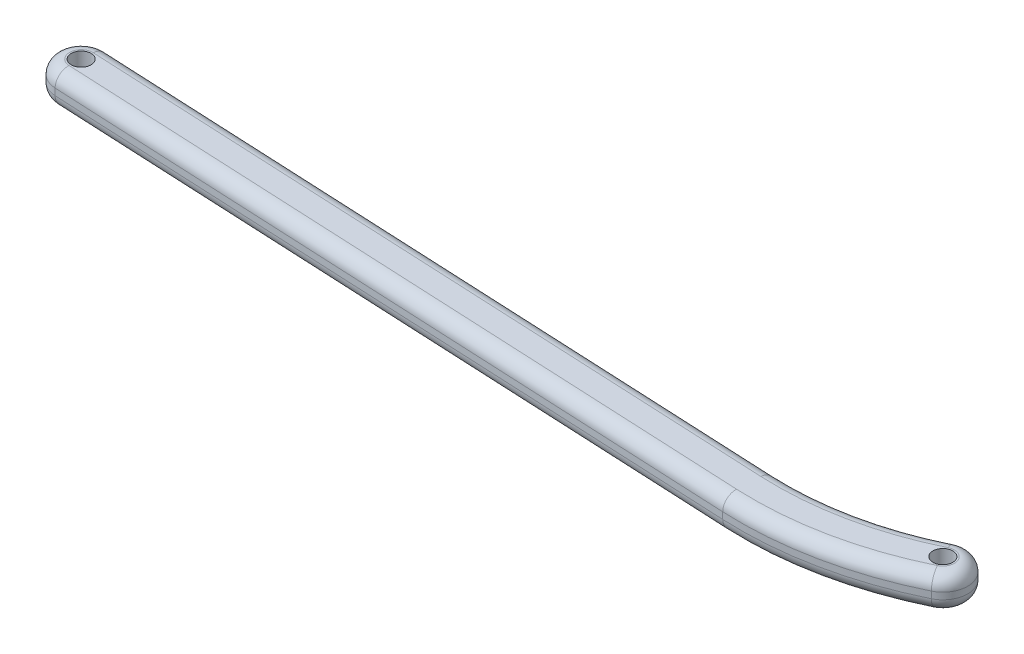
from build123d import *

# Parameters (mm, degrees)
CROQUIS1_R              = 3
SALIENTE_EXTRUIR1_DEPTH = 5
REDONDEO7_R             = 4


with BuildPart() as part:
    # Croquis1 → Saliente-Extruir1 (new, symmetric)
    with BuildSketch(Plane(origin=(0, 0, 0), x_dir=(-1, 0, 0), z_dir=(0, 1, 0))):
        with BuildLine():
            Line((48.918375148, 17.499676772), (260.354605919, 7.491612286))
            ThreePointArc((260.354605919, 7.491612286), (267.491612286, -0.354605919), (259.645394081, -7.491612286))
            Line((259.645394081, -7.491612286), (48.20916331, 2.5164522))
            ThreePointArc((48.20916331, 2.5164522), (25.165540725, 0.716123081), (3.287676773, -6.741007449))
            ThreePointArc((3.287676773, -6.741007449), (-6.741007449, -3.287676773), (-3.287676773, 6.741007449))
            ThreePointArc((-3.287676773, 6.741007449), (22.137948899, 15.40740239), (48.918375148, 17.499676772))
        make_face()
        with Locations(Location((0, 0, 0), (0, 0, 90))):
            Circle(CROQUIS1_R, mode=Mode.SUBTRACT)
        with Locations(Location((260, 0, 0), (0, 0, 90))):
            Circle(CROQUIS1_R, mode=Mode.SUBTRACT)
    extrude(amount=SALIENTE_EXTRUIR1_DEPTH, both=True)

    # Redondeo7
    redondeo7_edges = [part.edges().sort_by_distance(p)[0] for p in [
        (-153.927278696, 5, -2.487580043),
        (-267.491612286, 5, -0.354605919),
        (-154.636490533, 5, 12.495644529),
        (-22.137948899, 5, 15.40740239),
        (6.741007449, 5, -3.287676773),
        (-22.137948899, -5, 15.40740239),
        (-154.636490533, -5, 12.495644529),
        (-267.491612286, -5, -0.354605919),
        (-153.927278696, -5, -2.487580043),
        (-25.165540725, -5, 0.716123081),
        (6.741007449, -5, -3.287676773),
        (-25.165540725, 5, 0.716123081),
    ]]
    fillet(redondeo7_edges, radius=REDONDEO7_R)


solid = part.part
